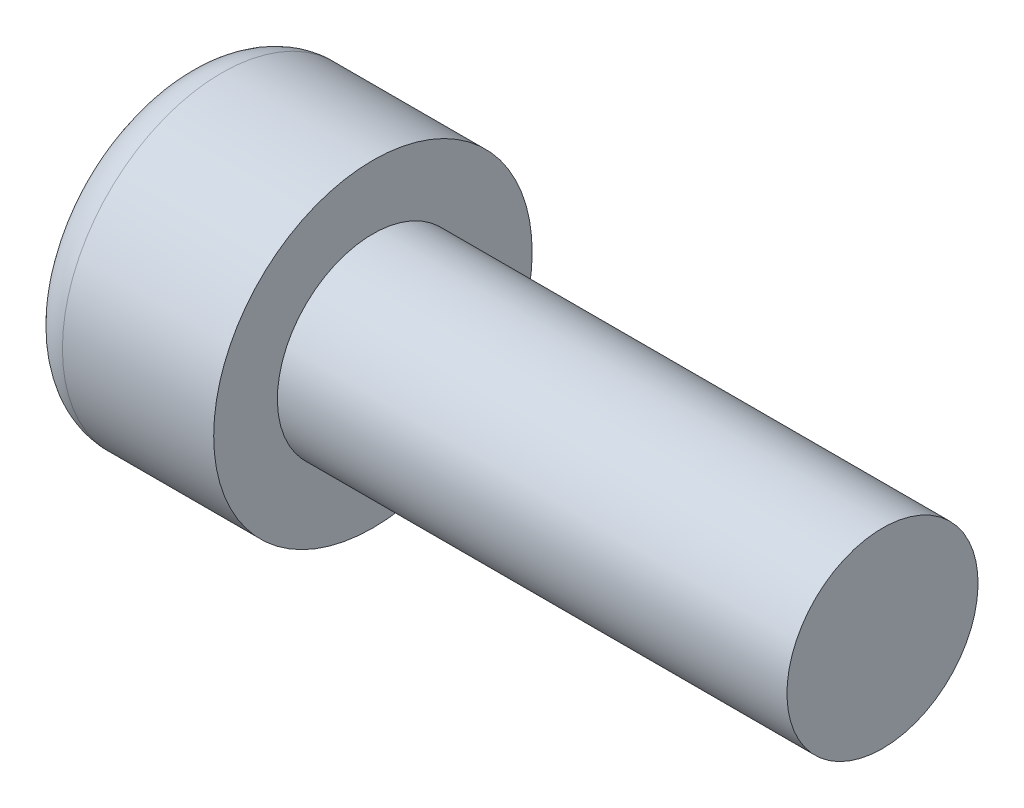
from build123d import *

# Parameters (mm, degrees)
CUT_EXTRUDE1_DEPTH = 3.5


with BuildPart() as part:
    # Sketch1 → Revolve1 (revolve)
    with BuildSketch(Plane.XY, mode=Mode.PRIVATE) as revolve1_sk:
        with BuildLine():
            Line((0, 0), (0, 3.75))
            ThreePointArc((0, 3.75), (0.366116524, 4.633883476), (1.25, 5))
            Line((1.25, 5), (6, 5))
            Line((6, 5), (6, 3))
            Line((6, 3), (22, 3))
            Line((22, 3), (22, 0))
            Line((22, 0), (0, 0))
        make_face()
    revolve(revolve1_sk.sketch.rotate(Axis((0, 0, 0), (1, 0, 0)), 180), axis=Axis((0, 0, 0), (1, 0, 0)))

    # Sketch2 → Cut-Extrude1 (cut)
    with BuildSketch(Plane.ZY):
        Polygon((0, 2.886751346), (-2.5, 1.443375673), (-2.5, -1.443375673), (0, -2.886751346), (2.5, -1.443375673), (2.5, 1.443375673), align=None)
    extrude(amount=-CUT_EXTRUDE1_DEPTH, mode=Mode.SUBTRACT)


solid = part.part
